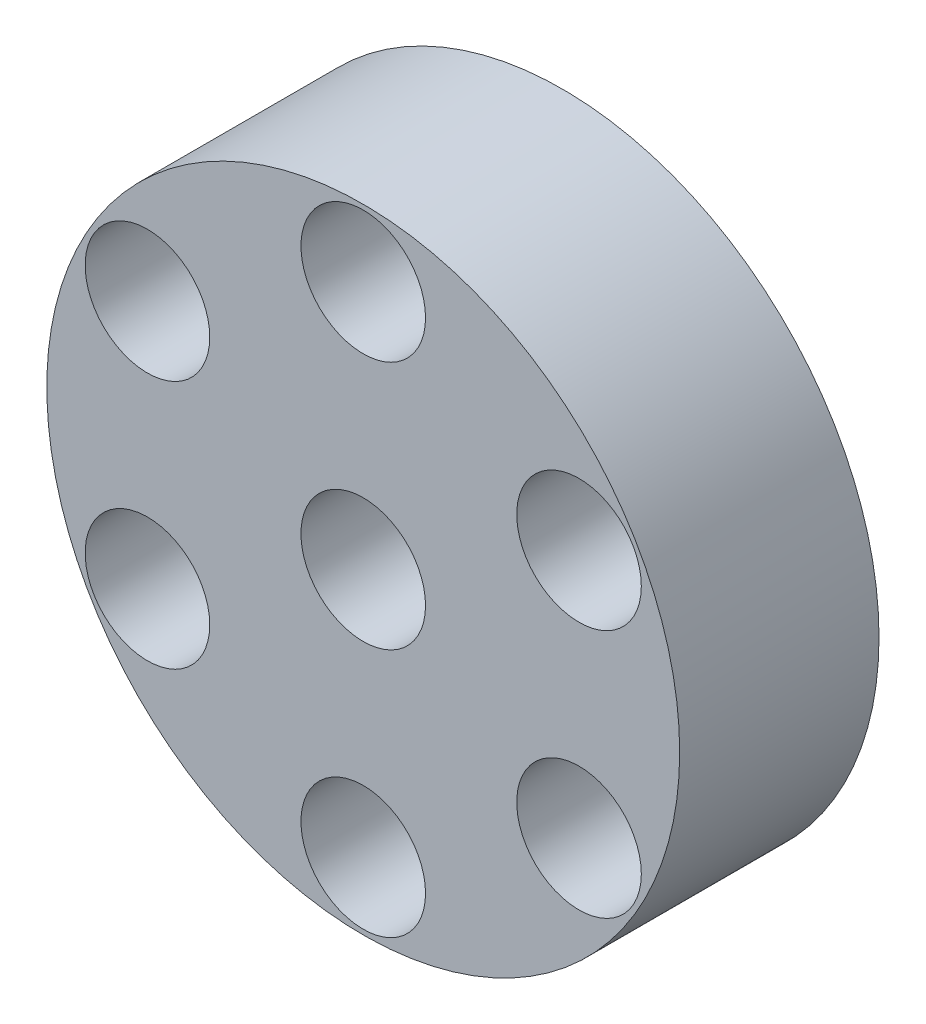
from build123d import *

# Parameters (mm, degrees)
SKETCH1_R           = 12.7
BOSS_EXTRUDE1_DEPTH = 8
SKETCH2_R           = 2.5
CUT_EXTRUDE1_DEPTH  = 8


with BuildPart() as part:
    # Sketch1 → Boss-Extrude1 (new body)
    with BuildSketch(Plane.XY):
        Circle(SKETCH1_R)
    extrude(amount=BOSS_EXTRUDE1_DEPTH)

    # Sketch2 → Cut-Extrude1 (cut)
    with BuildSketch(Plane.XY.offset(8)):
        with Locations((0, 10)):
            Circle(SKETCH2_R)
        with Locations((8.660254038, 5)):
            Circle(SKETCH2_R)
        with Locations((8.660254038, -5)):
            Circle(SKETCH2_R)
        with Locations((0, -10)):
            Circle(SKETCH2_R)
        with Locations((-8.660254038, -5)):
            Circle(SKETCH2_R)
        with Locations((-8.660254038, 5)):
            Circle(SKETCH2_R)
        Circle(SKETCH2_R)
    extrude(amount=-CUT_EXTRUDE1_DEPTH, mode=Mode.SUBTRACT)


solid = part.part
